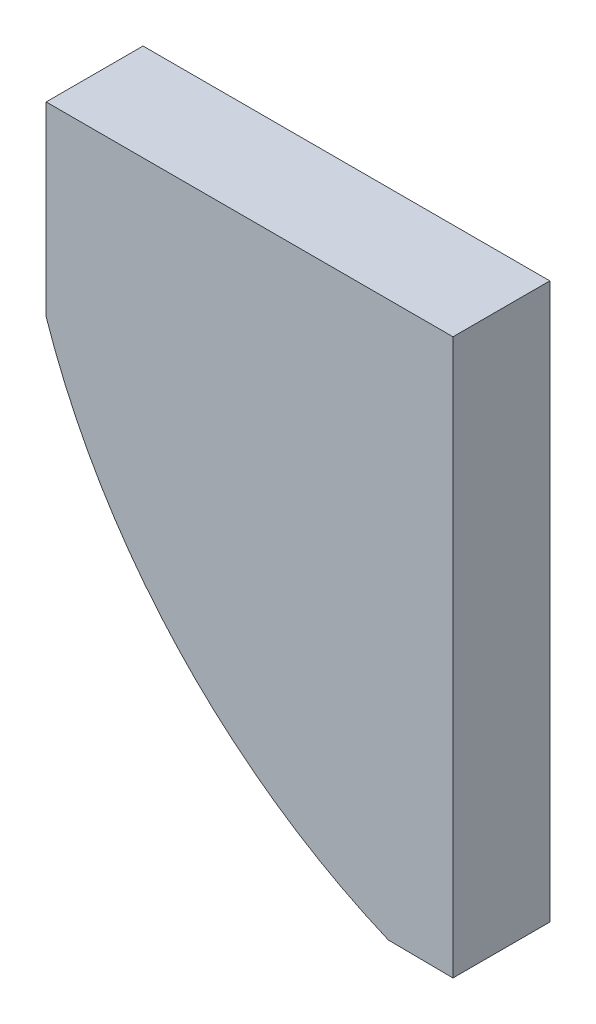
from build123d import *

# Parameters (mm, degrees)
BOSS_EXTRUDE1_DEPTH = 15
SHELL1_T            = -5


with BuildPart() as part:
    # Sketch1 → Boss-Extrude1 (new body)
    with BuildSketch(Plane.XY):
        with BuildLine():
            Line((-97.924180929, -245.60870674), (-107.924180929, -245.521090808))
            ThreePointArc((-107.924180929, -245.521090808), (-140.543987168, -222.66060862), (-160.924180929, -188.436332043))
            Line((-160.924180929, -188.436332043), (-160.924180929, -159.60870674))
            Line((-160.924180929, -159.60870674), (-97.924180929, -159.60870674))
            Line((-97.924180929, -159.60870674), (-97.924180929, -245.60870674))
        make_face()
    extrude(amount=BOSS_EXTRUDE1_DEPTH)

    # Shell1
    shell1_openings = [part.faces().sort_by_distance(p)[0] for p in [
        (-125.349491383, -195.90901573, 0),
    ]]
    offset(amount=SHELL1_T, openings=shell1_openings, kind=Kind.INTERSECTION)


solid = part.part
